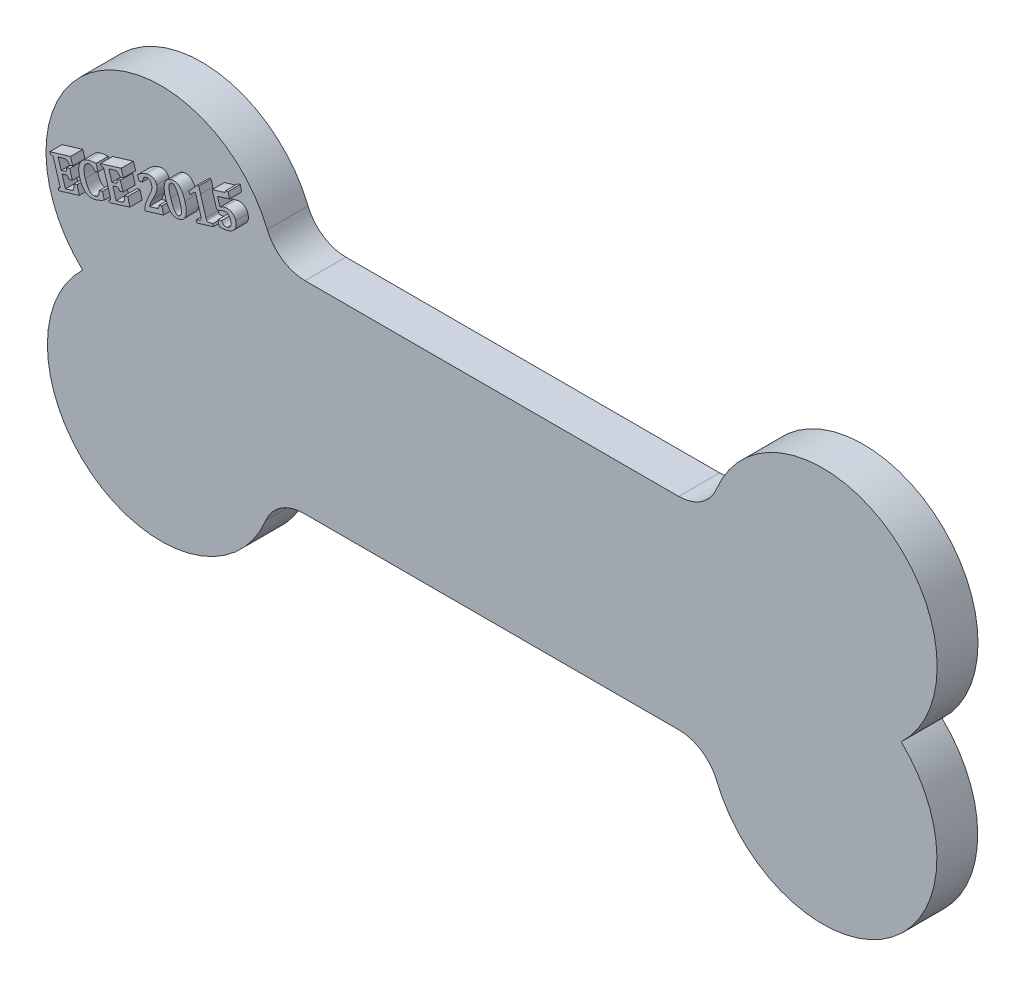
from build123d import *

# Parameters (mm, degrees)
SKETCH1_R           = 14.289546571
SKETCH1_R_2         = 14.252467891
SKETCH1_R_3         = 14.113624557
SKETCH1_R_4         = 14.218971536
SKETCH1_W           = 100.079406418
SKETCH1_H           = 25.144313168
BOSS_EXTRUDE1_DEPTH = 5.08
FILLET1_R           = 5.08
FILLET2_R           = 5.08
FILLET3_R           = 5.08
FILLET4_R           = 5.08
BOSS_EXTRUDE2_DEPTH = 1.524


with BuildPart() as part:
    # Sketch1 → Boss-Extrude1 (new body)
    with BuildSketch(Plane.XY):
        with Locations((-41.16080486, 10.341389949)):
            Circle(SKETCH1_R)
        with Locations((41.16080486, 10.341389949)):
            Circle(SKETCH1_R_2)
        with Locations((-41.16080486, -10.341389949)):
            Circle(SKETCH1_R_3)
        with Locations((41.16080486, -10.341389949)):
            Circle(SKETCH1_R_4)
        Rectangle(SKETCH1_W, SKETCH1_H)
    extrude(amount=BOSS_EXTRUDE1_DEPTH)

    # Fillet1
    fillet1_edges = [part.edges().sort_by_distance(p)[0] for p in [
        (27.083996941, 12.572156584, 2.54),
    ]]
    fillet(fillet1_edges, radius=FILLET1_R)

    # Fillet2
    fillet2_edges = [part.edges().sort_by_distance(p)[0] for p in [
        (-27.04645679, 12.572156584, 2.54),
    ]]
    fillet(fillet2_edges, radius=FILLET2_R)

    # Fillet3
    fillet3_edges = [part.edges().sort_by_distance(p)[0] for p in [
        (27.117912289, -12.572156584, 2.54),
    ]]
    fillet(fillet3_edges, radius=FILLET3_R)

    # Fillet4
    fillet4_edges = [part.edges().sort_by_distance(p)[0] for p in [
        (-27.224590225, -12.572156584, 2.54),
    ]]
    fillet(fillet4_edges, radius=FILLET4_R)

    # Sketch2 → Boss-Extrude2 (add)
    # profile 1 of 7: a face of its own
    with BuildSketch(Plane.XY.offset(5.08)):
        with BuildLine():
            Line((-50.60639535, 12.005929481), (-50.876098543, 12.894798848))
            Line((-50.876098543, 12.894798848), (-53.46048006, 12.109534976))
            Line((-53.46048006, 12.109534976), (-53.393876527, 11.889989999))
            add(Edge.make_bspline(
                [(-52.944097116, 11.500235993), (-52.957887359, 11.54973662), (-52.981139766, 11.616679117), (-53.0099987, 11.698050557), (-53.034458474, 11.751190268), (-53.06016311, 11.801376889), (-53.096810298, 11.844051331), (-53.137359515, 11.869870685), (-53.176501014, 11.882965262), (-53.217566782, 11.887305671), (-53.288203729, 11.892802268), (-53.348727026, 11.889897299), (-53.393876527, 11.889989999)],
                knots=[0, 0, 0, 0, 0.224874076, 0.310761561, 0.377954199, 0.481192858, 0.556895112, 0.621191654, 0.689554798, 0.735586859, 0.801817313, 1, 1, 1, 1], degree=3))
            Line((-52.944097116, 11.500235993), (-52.261616474, 9.255450266))
            add(Edge.make_bspline(
                [(-52.419491514, 8.683153246), (-52.371641974, 8.711085179), (-52.310419646, 8.752538841), (-52.241806102, 8.805305751), (-52.214143184, 8.837298233), (-52.201610858, 8.869653359), (-52.192514517, 8.902685606), (-52.1922069, 8.940590743), (-52.194290601, 8.983838483), (-52.203925775, 9.035292335), (-52.222717719, 9.127671213), (-52.246121284, 9.201653855), (-52.261616474, 9.255450266)],
                knots=[0, 0, 0, 0, 0.24185375, 0.322647174, 0.377998681, 0.423593048, 0.472961744, 0.526896437, 0.5880677, 0.662082012, 0.75507664, 1, 1, 1, 1], degree=3))
            Line((-52.419491514, 8.683153246), (-52.352065715, 8.461963737))
            Line((-52.352065715, 8.461963737), (-49.794818972, 9.23900495))
            Line((-49.794818972, 9.23900495), (-50.050543646, 10.271770837))
            Line((-50.050543646, 10.271770837), (-50.452631639, 10.149253228))
            add(Edge.make_bspline(
                [(-50.804561416, 9.296563558), (-50.768256245, 9.30728359), (-50.718090314, 9.325504179), (-50.65660397, 9.351485323), (-50.610708742, 9.377767503), (-50.562672837, 9.415550768), (-50.519025972, 9.474390479), (-50.488843827, 9.546124419), (-50.468688529, 9.629502311), (-50.456269517, 9.721311998), (-50.45160728, 9.804115071), (-50.450842937, 9.880370029), (-50.450881029, 9.99110783), (-50.452534683, 10.082646505), (-50.452631639, 10.149253228)],
                knots=[0, 0, 0, 0, 0.110437642, 0.155960841, 0.19468998, 0.264711615, 0.332764861, 0.406252598, 0.490527799, 0.582693775, 0.676534569, 0.732584137, 0.805441141, 1, 1, 1, 1], degree=3))
            Line((-50.804561416, 9.296563558), (-51.506776438, 9.083596707))
            Line((-51.506776438, 9.083596707), (-51.930243343, 10.475692764))
            Line((-51.930243343, 10.475692764), (-51.479641665, 10.612188893))
            add(Edge.make_bspline(
                [(-51.038084913, 10.330151712), (-51.06704983, 10.379558991), (-51.106044881, 10.447787397), (-51.162839901, 10.523296081), (-51.20325782, 10.570234507), (-51.251872986, 10.609421044), (-51.304619611, 10.632966887), (-51.349176958, 10.637091111), (-51.404842285, 10.632324656), (-51.448994851, 10.622850166), (-51.479641665, 10.612188893)],
                knots=[0, 0, 0, 0, 0.292723782, 0.3995801, 0.481814788, 0.608289109, 0.715556537, 0.770389573, 0.834863604, 1, 1, 1, 1], degree=3))
            Line((-51.038084913, 10.330151712), (-50.64586411, 10.449380258))
            Line((-50.64586411, 10.449380258), (-50.980526304, 11.551216475))
            Line((-50.980526304, 11.551216475), (-51.371924841, 11.431987929))
            add(Edge.make_bspline(
                [(-51.580780363, 10.946028821), (-51.551122062, 10.955393057), (-51.509485727, 10.969991973), (-51.461919136, 10.996971318), (-51.426130894, 11.023836926), (-51.392378732, 11.070831115), (-51.37448949, 11.130701699), (-51.366358712, 11.192470079), (-51.363904773, 11.290375983), (-51.368658902, 11.372006354), (-51.371924841, 11.431987929)],
                knots=[0, 0, 0, 0, 0.157418316, 0.221276102, 0.275533999, 0.382377757, 0.506233221, 0.587263332, 0.696675603, 1, 1, 1, 1], degree=3))
            Line((-51.580780363, 10.946028821), (-52.03138204, 10.809532693))
            Line((-52.03138204, 10.809532693), (-52.412913387, 12.064310356))
            Line((-52.412913387, 12.064310356), (-51.697542111, 12.281388536))
            add(Edge.make_bspline(
                [(-51.005194279, 11.885056404), (-51.035266082, 11.929809285), (-51.078657712, 11.992231962), (-51.136016698, 12.06786277), (-51.182975154, 12.123999988), (-51.234708606, 12.182287837), (-51.294718146, 12.238052126), (-51.35135991, 12.279386237), (-51.408744459, 12.306304509), (-51.470128211, 12.320626012), (-51.56858767, 12.316764205), (-51.644305301, 12.297265922), (-51.697542111, 12.281388536)],
                knots=[0, 0, 0, 0, 0.182972254, 0.257946892, 0.322020039, 0.431328752, 0.522180258, 0.599601812, 0.668270096, 0.735967643, 0.811316394, 1, 1, 1, 1], degree=3))
            Line((-51.005194279, 11.885056404), (-50.60639535, 12.005929481))
        make_face()
    # profile 2 of 7: a face of its own
    with BuildSketch(Plane.XY.offset(5.08)):
        with BuildLine():
            Line((-47.461857404, 12.930946155), (-47.705248091, 13.732655343))
            add(Edge.make_bspline(
                [(-48.746236637, 13.569024442), (-48.595310858, 13.614463311), (-48.403151167, 13.662840296), (-48.162527232, 13.69990875), (-47.968808037, 13.720151633), (-47.814197697, 13.728757888), (-47.705248091, 13.732655343)],
                knots=[0, 0, 0, 0, 0.447472762, 0.560770241, 0.690635786, 1, 1, 1, 1], degree=3))
            add(Edge.make_bspline(
                [(-49.723088448, 11.195965245), (-49.750729195, 11.287654468), (-49.786607413, 11.424937791), (-49.823005456, 11.607815648), (-49.840359925, 11.740845718), (-49.85352322, 11.870785659), (-49.858039055, 11.998181325), (-49.856893956, 12.123103354), (-49.847435507, 12.245219606), (-49.83271871, 12.364368549), (-49.808155544, 12.478975749), (-49.778156631, 12.589621684), (-49.740075769, 12.695540049), (-49.695865066, 12.797648166), (-49.642716467, 12.894486908), (-49.583481451, 12.987868372), (-49.517133557, 13.076803275), (-49.442779073, 13.159505674), (-49.363087481, 13.237351852), (-49.276032014, 13.308435042), (-49.182573534, 13.372893294), (-49.082963081, 13.431937281), (-48.939508934, 13.503041239), (-48.82470072, 13.544475086), (-48.746236637, 13.569024442)],
                knots=[0, 0, 0, 0, 0.099123032, 0.146814076, 0.192922299, 0.237956323, 0.281970453, 0.324820404, 0.367214155, 0.408709567, 0.449000015, 0.488445295, 0.527306564, 0.565423127, 0.603513277, 0.64153255, 0.679838749, 0.718224735, 0.756551947, 0.795063577, 0.834418943, 0.873982433, 0.914843364, 1, 1, 1, 1], degree=3))
            add(Edge.make_bspline(
                [(-47.780896548, 9.787423872), (-47.888810725, 9.753900797), (-48.051132886, 9.719387515), (-48.266354088, 9.706927941), (-48.417590107, 9.717069979), (-48.563082733, 9.743729838), (-48.702236278, 9.789584884), (-48.835218, 9.852671464), (-48.961441979, 9.934000055), (-49.081241129, 10.03270648), (-49.193957271, 10.1484477), (-49.299631718, 10.281145155), (-49.398093404, 10.431008488), (-49.491139355, 10.597316595), (-49.60852434, 10.850625634), (-49.678892493, 11.054755184), (-49.723088448, 11.195965245)],
                knots=[0, 0, 0, 0, 0.124043543, 0.181306073, 0.236200668, 0.290093607, 0.343296384, 0.396607163, 0.45129097, 0.507745811, 0.566698889, 0.628366646, 0.693725999, 0.763386922, 0.837442092, 1, 1, 1, 1], degree=3))
            add(Edge.make_bspline(
                [(-46.660148216, 10.293939626), (-46.753503591, 10.236097298), (-46.891643845, 10.154812144), (-47.075875381, 10.05807004), (-47.207733162, 9.996444093), (-47.341233156, 9.940446754), (-47.53104424, 9.867603182), (-47.678991769, 9.817927219), (-47.780896548, 9.787423872)],
                knots=[0, 0, 0, 0, 0.267008729, 0.389509288, 0.50577204, 0.62074817, 0.741407939, 1, 1, 1, 1], degree=3))
            Line((-46.660148216, 10.293939626), (-46.910939295, 11.118672257))
            Line((-46.910939295, 11.118672257), (-47.311382757, 10.996976914))
            add(Edge.make_bspline(
                [(-47.8277657, 10.136886851), (-47.766695899, 10.15460443), (-47.681501741, 10.187038879), (-47.580635114, 10.24352129), (-47.51992799, 10.288416856), (-47.46929493, 10.339858995), (-47.427476818, 10.398213585), (-47.391360203, 10.462665309), (-47.363952728, 10.53707678), (-47.342235401, 10.624972421), (-47.319823354, 10.779360462), (-47.312816097, 10.906049316), (-47.311382757, 10.996976914)],
                knots=[0, 0, 0, 0, 0.172645421, 0.246300972, 0.313274232, 0.376945593, 0.441394939, 0.507674199, 0.576915899, 0.655967326, 0.753109198, 1, 1, 1, 1], degree=3))
            add(Edge.make_bspline(
                [(-49.052119527, 11.447578591), (-49.027049617, 11.365328765), (-48.988068994, 11.245037349), (-48.930195495, 11.090479664), (-48.885108078, 10.983395928), (-48.840856501, 10.881219462), (-48.792518451, 10.786053897), (-48.744337817, 10.696027498), (-48.694260059, 10.612429488), (-48.643351287, 10.534977316), (-48.591609455, 10.464063741), (-48.538982864, 10.399997516), (-48.486395822, 10.342234694), (-48.43365129, 10.290872376), (-48.38043292, 10.246024406), (-48.325622294, 10.209235869), (-48.254812616, 10.167717398), (-48.163260905, 10.1314825), (-48.013528455, 10.101913871), (-47.899211608, 10.114695689), (-47.8277657, 10.136886851)],
                knots=[0, 0, 0, 0, 0.130272212, 0.19150934, 0.249963193, 0.306291391, 0.360145413, 0.411612433, 0.460963821, 0.507722774, 0.55199077, 0.593887395, 0.633272306, 0.670273471, 0.705363576, 0.738533885, 0.770158055, 0.829609292, 0.886697648, 1, 1, 1, 1], degree=3))
            add(Edge.make_bspline(
                [(-48.696078421, 13.219561463), (-48.767545918, 13.199271208), (-48.867053325, 13.143645062), (-48.979059014, 13.038488252), (-49.039138576, 12.957125006), (-49.081489132, 12.883461915), (-49.110045297, 12.821835537), (-49.135020564, 12.755156908), (-49.154106975, 12.682481417), (-49.171902162, 12.605073248), (-49.183770088, 12.521714713), (-49.19171519, 12.433332504), (-49.197012418, 12.340080347), (-49.196681049, 12.242105819), (-49.192048114, 12.139980173), (-49.180589345, 12.033939789), (-49.166359523, 11.923803397), (-49.14553128, 11.809971449), (-49.109011894, 11.650289542), (-49.077877677, 11.528828019), (-49.052119527, 11.447578591)],
                knots=[0, 0, 0, 0, 0.111151475, 0.168977248, 0.23032394, 0.262685756, 0.296853573, 0.33251268, 0.369770504, 0.40993619, 0.452089415, 0.496454788, 0.543582622, 0.59270947, 0.643960364, 0.697485256, 0.753301427, 0.811199363, 0.871694199, 1, 1, 1, 1], degree=3))
            add(Edge.make_bspline(
                [(-47.864767663, 12.808428546), (-47.908897761, 12.876958392), (-47.972757319, 12.973173626), (-48.069053676, 13.080260656), (-48.135209385, 13.138622205), (-48.200624329, 13.182710666), (-48.265219488, 13.217680976), (-48.331405972, 13.24051463), (-48.398641664, 13.254216157), (-48.467743908, 13.257587099), (-48.56841201, 13.253728817), (-48.644360296, 13.233724256), (-48.696078421, 13.219561463)],
                knots=[0, 0, 0, 0, 0.24020046, 0.338390045, 0.42297995, 0.49903129, 0.570095912, 0.638450218, 0.704244686, 0.771302193, 0.841538313, 1, 1, 1, 1], degree=3))
            Line((-47.864767663, 12.808428546), (-47.461857404, 12.930946155))
        make_face()
    # profile 3 of 7: a face of its own
    with BuildSketch(Plane.XY.offset(5.08)):
        with BuildLine():
            Line((-44.301973566, 13.8836985), (-44.57167676, 14.772567867))
            Line((-44.57167676, 14.772567867), (-47.156058276, 13.987303996))
            Line((-47.156058276, 13.987303996), (-47.089454743, 13.767759018))
            add(Edge.make_bspline(
                [(-46.639675332, 13.378005013), (-46.653465575, 13.427505639), (-46.676717983, 13.494448136), (-46.705576916, 13.575819576), (-46.730036691, 13.628959287), (-46.755741326, 13.679145908), (-46.792388514, 13.721820351), (-46.832937731, 13.747639704), (-46.87207923, 13.760734281), (-46.913144999, 13.765074691), (-46.983781945, 13.770571287), (-47.044305242, 13.767666318), (-47.089454743, 13.767759018)],
                knots=[0, 0, 0, 0, 0.224874076, 0.310761561, 0.377954199, 0.481192858, 0.556895112, 0.621191654, 0.689554798, 0.735586859, 0.801817313, 1, 1, 1, 1], degree=3))
            Line((-46.639675332, 13.378005013), (-45.95719469, 11.133219286))
            add(Edge.make_bspline(
                [(-46.11506973, 10.560922265), (-46.06722019, 10.588854198), (-46.005997862, 10.630307861), (-45.937384319, 10.68307477), (-45.9097214, 10.715067252), (-45.897189074, 10.747422378), (-45.888092733, 10.780454625), (-45.887785117, 10.818359762), (-45.889868818, 10.861607502), (-45.899503992, 10.913061354), (-45.918295935, 11.005440232), (-45.9416995, 11.079422874), (-45.95719469, 11.133219286)],
                knots=[0, 0, 0, 0, 0.24185375, 0.322647174, 0.377998681, 0.423593048, 0.472961744, 0.526896437, 0.5880677, 0.662082012, 0.75507664, 1, 1, 1, 1], degree=3))
            Line((-46.11506973, 10.560922265), (-46.047643932, 10.339732756))
            Line((-46.047643932, 10.339732756), (-43.490397188, 11.116773969))
            Line((-43.490397188, 11.116773969), (-43.746121862, 12.149539856))
            Line((-43.746121862, 12.149539856), (-44.148209855, 12.027022247))
            add(Edge.make_bspline(
                [(-44.500139632, 11.174332577), (-44.463834461, 11.185052609), (-44.413668531, 11.203273199), (-44.352182187, 11.229254343), (-44.306286958, 11.255536522), (-44.258251053, 11.293319787), (-44.214604188, 11.352159498), (-44.184422044, 11.423893439), (-44.164266746, 11.50727133), (-44.151847734, 11.599081017), (-44.147185496, 11.68188409), (-44.146421153, 11.758139048), (-44.146459245, 11.868876849), (-44.1481129, 11.960415524), (-44.148209855, 12.027022247)],
                knots=[0, 0, 0, 0, 0.110437642, 0.155960841, 0.19468998, 0.264711615, 0.332764861, 0.406252598, 0.490527799, 0.582693775, 0.676534569, 0.732584137, 0.805441141, 1, 1, 1, 1], degree=3))
            Line((-44.500139632, 11.174332577), (-45.202354654, 10.961365726))
            Line((-45.202354654, 10.961365726), (-45.625821559, 12.353461783))
            Line((-45.625821559, 12.353461783), (-45.175219882, 12.489957912))
            add(Edge.make_bspline(
                [(-44.733663129, 12.207920731), (-44.762628046, 12.25732801), (-44.801623098, 12.325556416), (-44.858418117, 12.4010651), (-44.898836036, 12.448003526), (-44.947451203, 12.487190064), (-45.000197827, 12.510735906), (-45.044755175, 12.51486013), (-45.100420501, 12.510093675), (-45.144573067, 12.500619185), (-45.175219882, 12.489957912)],
                knots=[0, 0, 0, 0, 0.292723782, 0.3995801, 0.481814788, 0.608289109, 0.715556537, 0.770389573, 0.834863604, 1, 1, 1, 1], degree=3))
            Line((-44.733663129, 12.207920731), (-44.341442326, 12.327149277))
            Line((-44.341442326, 12.327149277), (-44.676104521, 13.428985494))
            Line((-44.676104521, 13.428985494), (-45.067503058, 13.309756948))
            add(Edge.make_bspline(
                [(-45.276358579, 12.82379784), (-45.246700278, 12.833162076), (-45.205063943, 12.847760992), (-45.157497353, 12.874740337), (-45.12170911, 12.901605945), (-45.087956948, 12.948600135), (-45.070067707, 13.008470718), (-45.061936929, 13.070239099), (-45.059482989, 13.168145002), (-45.064237119, 13.249775373), (-45.067503058, 13.309756948)],
                knots=[0, 0, 0, 0, 0.157418316, 0.221276102, 0.275533999, 0.382377757, 0.506233221, 0.587263332, 0.696675603, 1, 1, 1, 1], degree=3))
            Line((-45.276358579, 12.82379784), (-45.726960256, 12.687301712))
            Line((-45.726960256, 12.687301712), (-46.108491603, 13.942079375))
            Line((-46.108491603, 13.942079375), (-45.393120328, 14.159157555))
            add(Edge.make_bspline(
                [(-44.700772496, 13.762825423), (-44.730844298, 13.807578304), (-44.774235929, 13.870000981), (-44.831594914, 13.945631789), (-44.87855337, 14.001769007), (-44.930286822, 14.060056856), (-44.990296362, 14.115821145), (-45.046938126, 14.157155256), (-45.104322676, 14.184073528), (-45.165706427, 14.198395031), (-45.264165886, 14.194533224), (-45.339883517, 14.175034941), (-45.393120328, 14.159157555)],
                knots=[0, 0, 0, 0, 0.182972254, 0.257946892, 0.322020039, 0.431328752, 0.522180258, 0.599601812, 0.668270096, 0.735967643, 0.811316394, 1, 1, 1, 1], degree=3))
            Line((-44.700772496, 13.762825423), (-44.301973566, 13.8836985))
        make_face()
    # profile 4 of 7: a face of its own
    with BuildSketch(Plane.XY.offset(5.08)):
        with BuildLine():
            Line((-39.513375385, 13.242077078), (-39.876816884, 13.131071191))
            add(Edge.make_bspline(
                [(-40.206545483, 12.656623804), (-40.169827288, 12.668147197), (-40.118608915, 12.684883019), (-40.056277532, 12.709492352), (-40.010822533, 12.73151538), (-39.966232987, 12.760010813), (-39.925137757, 12.799611299), (-39.901572426, 12.847304879), (-39.890713505, 12.893188636), (-39.886139023, 12.940258984), (-39.879712595, 13.017456679), (-39.87824677, 13.082835651), (-39.876816884, 13.131071191)],
                knots=[0, 0, 0, 0, 0.175900889, 0.2461514, 0.306096943, 0.406506657, 0.487117187, 0.563314564, 0.645953288, 0.701425816, 0.779343947, 1, 1, 1, 1], degree=3))
            Line((-40.206545483, 12.656623804), (-41.079791799, 12.39103194))
            add(Edge.make_bspline(
                [(-40.635768249, 13.424620093), (-40.686246157, 13.324306973), (-40.757240059, 13.176656316), (-40.845141784, 12.983694462), (-40.904048719, 12.850971153), (-40.956305388, 12.725533926), (-41.017108146, 12.574019535), (-41.056911664, 12.463099456), (-41.079791799, 12.39103194)],
                knots=[0, 0, 0, 0, 0.299221099, 0.43648775, 0.564998203, 0.686122084, 0.798551459, 1, 1, 1, 1], degree=3))
            add(Edge.make_bspline(
                [(-40.151453672, 15.17604632), (-40.125370963, 15.091249428), (-40.099625776, 14.961172602), (-40.101438306, 14.784686675), (-40.118259116, 14.649481589), (-40.153590817, 14.504874163), (-40.205665467, 14.349845412), (-40.271746194, 14.185979972), (-40.326841647, 14.058516293), (-40.369821593, 13.969051414), (-40.395083111, 13.914137428), (-40.426046697, 13.852167172), (-40.459018146, 13.781102311), (-40.498252574, 13.703540163), (-40.556357615, 13.583222883), (-40.604441823, 13.490356068), (-40.635768249, 13.424620093)],
                knots=[0, 0, 0, 0, 0.142877058, 0.211226361, 0.283203248, 0.36160136, 0.450286859, 0.546090663, 0.645798948, 0.673610533, 0.705763917, 0.743036927, 0.785048072, 0.831785043, 0.882861535, 1, 1, 1, 1], degree=3))
            add(Edge.make_bspline(
                [(-41.49996964, 15.725319897), (-41.416307466, 15.751927213), (-41.29186907, 15.781302322), (-41.128237106, 15.804720544), (-41.015163462, 15.811915453), (-40.907828418, 15.807479786), (-40.806116654, 15.794784215), (-40.710283302, 15.77194163), (-40.620803483, 15.738605075), (-40.5376187, 15.696918165), (-40.461548114, 15.64616995), (-40.39183295, 15.58827038), (-40.328627607, 15.522167279), (-40.273942907, 15.446639484), (-40.207255397, 15.334216261), (-40.171138855, 15.240760309), (-40.151453672, 15.17604632)],
                knots=[0, 0, 0, 0, 0.159197131, 0.231499835, 0.299749873, 0.364450349, 0.426137099, 0.485484012, 0.54276103, 0.599031696, 0.653929618, 0.708309228, 0.763186873, 0.819387167, 0.877130812, 1, 1, 1, 1], degree=3))
            add(Edge.make_bspline(
                [(-42.540958186, 15.081485749), (-42.447534347, 15.165526853), (-42.309182685, 15.284207299), (-42.11838708, 15.419769622), (-41.986621155, 15.504480326), (-41.858697687, 15.575398761), (-41.700040131, 15.654635052), (-41.57924663, 15.700543518), (-41.49996964, 15.725319897)],
                knots=[0, 0, 0, 0, 0.305774494, 0.442459421, 0.568936841, 0.686508214, 0.797996807, 1, 1, 1, 1], degree=3))
            Line((-42.540958186, 15.081485749), (-42.363348766, 14.497677007))
            Line((-42.363348766, 14.497677007), (-41.907813494, 14.635817667))
            add(Edge.make_bspline(
                [(-41.506547767, 15.347077613), (-41.568903336, 15.327802171), (-41.658219417, 15.283521583), (-41.75215613, 15.191535694), (-41.808644518, 15.107885609), (-41.853448264, 15.010522571), (-41.8958027, 14.852673351), (-41.907536936, 14.72494422), (-41.907813494, 14.635817667)],
                knots=[0, 0, 0, 0, 0.222856957, 0.332542426, 0.444765561, 0.565170396, 0.69621394, 1, 1, 1, 1], degree=3))
            add(Edge.make_bspline(
                [(-40.796932352, 14.894009139), (-40.814547108, 14.951242973), (-40.845777142, 15.033702273), (-40.903777245, 15.132192518), (-40.950307111, 15.196577113), (-41.002157552, 15.252686694), (-41.060436853, 15.297744856), (-41.122552496, 15.335210659), (-41.190629352, 15.360417066), (-41.263218424, 15.375591088), (-41.370410448, 15.379898363), (-41.452073601, 15.362848994), (-41.506547767, 15.347077613)],
                knots=[0, 0, 0, 0, 0.188393342, 0.275231115, 0.358418761, 0.437610895, 0.514267192, 0.589142362, 0.66462901, 0.741130387, 0.821285732, 1, 1, 1, 1], degree=3))
            add(Edge.make_bspline(
                [(-40.896426518, 14.001028443), (-40.868749213, 14.06968479), (-40.835876862, 14.169440364), (-40.798503118, 14.296669104), (-40.775213746, 14.401467641), (-40.757368681, 14.519983437), (-40.754150014, 14.693163044), (-40.773298762, 14.816641288), (-40.796932352, 14.894009139)],
                knots=[0, 0, 0, 0, 0.242226679, 0.343959769, 0.434126939, 0.5937135, 0.735580459, 1, 1, 1, 1], degree=3))
            add(Edge.make_bspline(
                [(-41.175174636, 13.368706017), (-41.144569878, 13.434530331), (-41.099528148, 13.52949014), (-41.043625398, 13.652423333), (-41.007584674, 13.734835329), (-40.974465167, 13.810659671), (-40.937186454, 13.898421625), (-40.912005415, 13.96143362), (-40.896426518, 14.001028443)],
                knots=[0, 0, 0, 0, 0.315081509, 0.456171868, 0.586145986, 0.705493337, 0.815311141, 1, 1, 1, 1], degree=3))
            add(Edge.make_bspline(
                [(-41.646332959, 11.857381414), (-41.635317972, 11.967375074), (-41.611836354, 12.134034638), (-41.559511903, 12.355355368), (-41.521309629, 12.498168695), (-41.484086338, 12.615877013), (-41.451964288, 12.709623953), (-41.415680095, 12.808280057), (-41.375566101, 12.911705791), (-41.330872895, 13.019205642), (-41.265764804, 13.172937348), (-41.211766161, 13.289143942), (-41.175174636, 13.368706017)],
                knots=[0, 0, 0, 0, 0.208483012, 0.316657381, 0.428598252, 0.487105197, 0.549364155, 0.615408596, 0.68526655, 0.758483699, 0.834882842, 1, 1, 1, 1], degree=3))
            Line((-41.646332959, 11.857381414), (-41.58877435, 11.668260272))
            Line((-41.58877435, 11.668260272), (-39.298764002, 12.363897168))
            Line((-39.298764002, 12.363897168), (-39.513375385, 13.242077078))
        make_face()
    # profile 5 of 7: a face of its own
    with BuildSketch(Plane.XY.offset(5.08)):
        with BuildLine():
            Line((-33.08480067, 14.214689579), (-33.172783114, 14.504949418))
            add(Edge.make_bspline(
                [(-34.030406379, 14.725316661), (-34.016263635, 14.680994441), (-33.997036598, 14.619221671), (-33.96738014, 14.545600898), (-33.942889852, 14.495772868), (-33.91204061, 14.449999842), (-33.870413067, 14.409563959), (-33.819211012, 14.390476605), (-33.771610516, 14.383792707), (-33.726377482, 14.385600031), (-33.684693363, 14.388904675), (-33.636639151, 14.394667338), (-33.579621649, 14.40446917), (-33.507880758, 14.418813762), (-33.370794628, 14.453703792), (-33.256290646, 14.481838017), (-33.172783114, 14.504949418)],
                knots=[0, 0, 0, 0, 0.130312052, 0.180896438, 0.222074686, 0.285502148, 0.334950587, 0.381403035, 0.435660141, 0.46866345, 0.507916506, 0.552743516, 0.604084615, 0.669845481, 0.757500518, 1, 1, 1, 1], degree=3))
            Line((-34.030406379, 14.725316661), (-34.703842097, 16.941323084))
            add(Edge.make_bspline(
                [(-34.914342151, 17.689584993), (-34.902144878, 17.638706584), (-34.881881237, 17.559685122), (-34.852299966, 17.450728788), (-34.826568634, 17.360422766), (-34.799523748, 17.2638407), (-34.759129237, 17.123291987), (-34.726161445, 17.015289923), (-34.703842097, 16.941323084)],
                knots=[0, 0, 0, 0, 0.201896534, 0.3147945, 0.435674731, 0.564255169, 0.701843017, 1, 1, 1, 1], degree=3))
            Line((-34.914342151, 17.689584993), (-35.176644952, 17.609825207))
            Line((-35.176644952, 17.609825207), (-36.198721383, 16.470164761))
            Line((-36.198721383, 16.470164761), (-35.959442026, 16.24733072))
            add(Edge.make_bspline(
                [(-35.432369626, 16.759602335), (-35.455477905, 16.751112263), (-35.49024415, 16.723711027), (-35.540910151, 16.677468339), (-35.582687534, 16.635528375), (-35.62115223, 16.594277421), (-35.656584852, 16.558430292), (-35.696244212, 16.518052156), (-35.739847691, 16.472583975), (-35.788112723, 16.422456437), (-35.862621822, 16.347569799), (-35.919432639, 16.287909506), (-35.959442026, 16.24733072)],
                knots=[0, 0, 0, 0, 0.098831903, 0.178614143, 0.279600639, 0.33958213, 0.408225923, 0.484758818, 0.569980783, 0.664668772, 0.76802515, 1, 1, 1, 1], degree=3))
            add(Edge.make_bspline(
                [(-35.298340295, 16.639551523), (-35.30636498, 16.662992014), (-35.315905532, 16.696698923), (-35.339339317, 16.731415051), (-35.369238746, 16.762783949), (-35.407402395, 16.770050968), (-35.432369626, 16.759602335)],
                knots=[0, 0, 0, 0, 0.367684553, 0.5039895, 0.612226931, 1, 1, 1, 1], degree=3))
            Line((-35.298340295, 16.639551523), (-34.658617476, 14.534550988))
            add(Edge.make_bspline(
                [(-35.249004345, 13.875093789), (-35.198308381, 13.893486232), (-35.125429916, 13.919401582), (-35.033134147, 13.953881783), (-34.974325943, 13.976947303), (-34.922303656, 13.997244929), (-34.877652512, 14.016265945), (-34.840161779, 14.033411267), (-34.800229249, 14.052569465), (-34.759207117, 14.075715213), (-34.717012369, 14.102316381), (-34.683606863, 14.128760755), (-34.64951317, 14.163037572), (-34.620280439, 14.215227056), (-34.610538477, 14.277052355), (-34.611691889, 14.335298187), (-34.62539974, 14.418994723), (-34.644181998, 14.485979085), (-34.658617476, 14.534550988)],
                knots=[0, 0, 0, 0, 0.153580335, 0.220270637, 0.280570408, 0.333475411, 0.379289164, 0.418759118, 0.45087573, 0.505385912, 0.552800768, 0.592784485, 0.626456914, 0.69006583, 0.759112609, 0.802050006, 0.855698335, 1, 1, 1, 1], degree=3))
            Line((-35.249004345, 13.875093789), (-35.160199635, 13.584011684))
            Line((-35.160199635, 13.584011684), (-33.08480067, 14.214689579))
        make_face()
    # profile 6 of 7: a face of its own
    with BuildSketch(Plane.XY.offset(5.08)):
        with BuildLine():
            Line((-32.547399735, 15.232179557), (-32.353344998, 14.592456739))
            add(Edge.make_bspline(
                [(-31.300022465, 14.694417702), (-31.378055307, 14.670414418), (-31.498967509, 14.641698005), (-31.664110537, 14.613491788), (-31.793906052, 14.597871112), (-31.927808176, 14.588063274), (-32.114903499, 14.582959658), (-32.257278939, 14.586024818), (-32.353344998, 14.592456739)],
                knots=[0, 0, 0, 0, 0.230109159, 0.350066547, 0.472305753, 0.598638229, 0.728552008, 1, 1, 1, 1], degree=3))
            add(Edge.make_bspline(
                [(-30.329748781, 16.253433723), (-30.29658257, 16.143520797), (-30.263075975, 15.976045093), (-30.26755713, 15.753591473), (-30.288672325, 15.621796212), (-30.317159099, 15.520639481), (-30.344579864, 15.447038155), (-30.377357039, 15.375459362), (-30.416244217, 15.30625589), (-30.460628543, 15.239113581), (-30.512275909, 15.175410802), (-30.567930968, 15.112215623), (-30.652263807, 15.032251981), (-30.769186499, 14.937969436), (-30.988583603, 14.806312081), (-31.171344023, 14.732930624), (-31.300022465, 14.694417702)],
                knots=[0, 0, 0, 0, 0.166021896, 0.243994348, 0.320174885, 0.35800682, 0.395568746, 0.433460652, 0.471550406, 0.510073477, 0.54950253, 0.589857974, 0.631558808, 0.717152827, 0.806125969, 1, 1, 1, 1], degree=3))
            add(Edge.make_bspline(
                [(-31.807360484, 16.979494455), (-31.698080939, 17.012695895), (-31.53200403, 17.045592966), (-31.310632295, 17.047242551), (-31.153719041, 17.027361465), (-31.004767043, 16.989285156), (-30.867121068, 16.932279392), (-30.741511, 16.857350716), (-30.63000995, 16.763930574), (-30.531629093, 16.65566324), (-30.41877449, 16.490751909), (-30.358849704, 16.351029683), (-30.329748781, 16.253433723)],
                knots=[0, 0, 0, 0, 0.185208964, 0.272292729, 0.35782118, 0.440906308, 0.520777653, 0.598498261, 0.677058843, 0.755691005, 0.834933349, 1, 1, 1, 1], degree=3))
            add(Edge.make_bspline(
                [(-32.276874275, 16.711435793), (-32.274810133, 16.738547161), (-32.243954133, 16.775105541), (-32.185457564, 16.816923518), (-32.045104079, 16.893544966), (-31.91567416, 16.946114575), (-31.807360484, 16.979494455)],
                knots=[0, 0, 0, 0, 0.138738628, 0.247649917, 0.388795225, 1, 1, 1, 1], degree=3))
            Line((-32.276874275, 16.711435793), (-32.590979824, 17.745023946))
            Line((-32.590979824, 17.745023946), (-31.104323196, 18.197270155))
            Line((-31.104323196, 18.197270155), (-31.27535449, 18.918397291))
            Line((-31.27535449, 18.918397291), (-31.619061608, 18.81396953))
            add(Edge.make_bspline(
                [(-31.774469851, 18.578801502), (-31.752221198, 18.584898016), (-31.723344438, 18.596187442), (-31.688733315, 18.610221072), (-31.668280183, 18.623205664), (-31.649646353, 18.640520636), (-31.63698159, 18.663214339), (-31.631130286, 18.688791365), (-31.62369631, 18.738025006), (-31.621870642, 18.781400987), (-31.619061608, 18.81396953)],
                knots=[0, 0, 0, 0, 0.216816435, 0.293218683, 0.351327858, 0.444596931, 0.530241994, 0.591706336, 0.691184984, 1, 1, 1, 1], degree=3))
            Line((-31.774469851, 18.578801502), (-33.25701515, 18.128199825))
            Line((-33.25701515, 18.128199825), (-32.712675168, 16.336482573))
            Line((-32.712675168, 16.336482573), (-32.410903606, 16.272345837))
            add(Edge.make_bspline(
                [(-31.860807763, 16.539582234), (-31.954102921, 16.510874378), (-32.067328196, 16.468661966), (-32.196523092, 16.401479951), (-32.288704338, 16.347323486), (-32.361522189, 16.304779429), (-32.410903606, 16.272345837)],
                knots=[0, 0, 0, 0, 0.477531844, 0.587782631, 0.711408393, 1, 1, 1, 1], degree=3))
            add(Edge.make_bspline(
                [(-30.973582929, 15.996064517), (-30.996458796, 16.07618238), (-31.041452721, 16.187765833), (-31.121204376, 16.31971072), (-31.187382669, 16.398002112), (-31.258465972, 16.461952799), (-31.333619131, 16.512418797), (-31.412818546, 16.549390033), (-31.496878279, 16.570316576), (-31.58342021, 16.580243505), (-31.706666412, 16.577625846), (-31.799182355, 16.557699642), (-31.860807763, 16.539582234)],
                knots=[0, 0, 0, 0, 0.210644969, 0.302844445, 0.388990432, 0.469057896, 0.544084518, 0.617333037, 0.689001278, 0.762305605, 0.837229557, 1, 1, 1, 1], degree=3))
            add(Edge.make_bspline(
                [(-31.383071314, 15.024146301), (-31.332567302, 15.039083874), (-31.259939065, 15.066321934), (-31.173206278, 15.116488936), (-31.115590529, 15.155539049), (-31.065790737, 15.200567192), (-31.022861267, 15.250107), (-30.986472661, 15.303950948), (-30.956291318, 15.361956984), (-30.934300194, 15.425190757), (-30.918736527, 15.493021576), (-30.909692388, 15.565467726), (-30.908249334, 15.642872147), (-30.914471925, 15.724757587), (-30.931314969, 15.84433859), (-30.955743041, 15.934572807), (-30.973582929, 15.996064517)],
                knots=[0, 0, 0, 0, 0.130959242, 0.191322012, 0.248532531, 0.303475275, 0.357516838, 0.410941946, 0.46451859, 0.519414938, 0.576706377, 0.637069148, 0.700383644, 0.768614564, 0.840807726, 1, 1, 1, 1], degree=3))
            add(Edge.make_bspline(
                [(-32.091864463, 15.370320218), (-32.062089179, 15.328168891), (-32.020556761, 15.266000517), (-31.958668888, 15.192582614), (-31.914353371, 15.146809628), (-31.871540725, 15.10694789), (-31.829751774, 15.073308182), (-31.787312121, 15.047949353), (-31.732684921, 15.021305198), (-31.661150645, 15.000718209), (-31.538212581, 14.990047578), (-31.444416088, 15.005159371), (-31.383071314, 15.024146301)],
                knots=[0, 0, 0, 0, 0.179680245, 0.259519217, 0.333691808, 0.401164206, 0.462961623, 0.51986538, 0.572744858, 0.674115001, 0.776577791, 1, 1, 1, 1], degree=3))
            Line((-32.091864463, 15.370320218), (-32.547399735, 15.232179557))
        make_face()
    # profile 7 of 7: a face of its own
    with BuildSketch(Plane.XY.offset(5.08)):
        with BuildLine():
            add(Edge.make_bspline(
                [(-37.338843175, 12.896250304), (-37.431316472, 12.868093769), (-37.571204675, 12.839200404), (-37.756998478, 12.836535085), (-37.887923475, 12.851910058), (-38.013342736, 12.885481749), (-38.134037254, 12.935025624), (-38.248826542, 13.003345315), (-38.35812535, 13.089103896), (-38.461678777, 13.192235849), (-38.56165998, 13.311135266), (-38.655689418, 13.447773427), (-38.746415737, 13.600321637), (-38.831680727, 13.770303139), (-38.941991736, 14.028141739), (-39.013494822, 14.233354302), (-39.056556502, 14.376328806)],
                knots=[0, 0, 0, 0, 0.113055791, 0.165589338, 0.216561765, 0.26659567, 0.316858705, 0.368550637, 0.422179103, 0.478802966, 0.539047977, 0.603467847, 0.672407375, 0.746321688, 0.825516812, 1, 1, 1, 1], degree=3))
            add(Edge.make_bspline(
                [(-36.649784406, 15.195305576), (-36.605720491, 15.050470287), (-36.549503554, 14.836745733), (-36.500250888, 14.555086086), (-36.478821438, 14.360369137), (-36.469505206, 14.176007852), (-36.47639744, 14.001676143), (-36.495371336, 13.83753999), (-36.529015434, 13.684033077), (-36.576065908, 13.54132874), (-36.639983744, 13.411233724), (-36.718555361, 13.292975253), (-36.813343714, 13.187864127), (-36.922932534, 13.095077101), (-37.093392902, 12.985496405), (-37.237706695, 12.926728059), (-37.338843175, 12.896250304)],
                knots=[0, 0, 0, 0, 0.167196051, 0.243673935, 0.315533922, 0.383397346, 0.447304547, 0.50797038, 0.565616635, 0.620554267, 0.673479155, 0.725188022, 0.776840169, 0.829234499, 0.883298977, 1, 1, 1, 1], degree=3))
            add(Edge.make_bspline(
                [(-38.431634468, 16.639204381), (-38.331177878, 16.669041454), (-38.180625487, 16.702006), (-37.981046886, 16.707851327), (-37.842153286, 16.695334261), (-37.709576895, 16.663592937), (-37.583525945, 16.613937549), (-37.464331427, 16.545568767), (-37.351648923, 16.459828228), (-37.245702918, 16.356790771), (-37.144462801, 16.238526105), (-37.047661847, 16.104641974), (-36.957985222, 15.953497186), (-36.87248173, 15.78701927), (-36.761597884, 15.53577565), (-36.691653674, 15.335107182), (-36.649784406, 15.195305576)],
                knots=[0, 0, 0, 0, 0.12070569, 0.175893968, 0.229092738, 0.280626334, 0.33213968, 0.384377117, 0.438156449, 0.494562009, 0.554021661, 0.617015426, 0.684322643, 0.755943679, 0.832152506, 1, 1, 1, 1], degree=3))
            add(Edge.make_bspline(
                [(-39.056556502, 14.376328806), (-39.102552997, 14.527534351), (-39.159927338, 14.749512352), (-39.208697278, 15.040356835), (-39.228000912, 15.237636132), (-39.232510486, 15.422364954), (-39.222829324, 15.595065586), (-39.200290479, 15.755878913), (-39.164306025, 15.904756556), (-39.115077577, 16.041905704), (-39.051747474, 16.166006788), (-38.976110198, 16.278426554), (-38.88699339, 16.37688848), (-38.787022989, 16.462756429), (-38.639827837, 16.560697172), (-38.51720253, 16.613894657), (-38.431634468, 16.639204381)],
                knots=[0, 0, 0, 0, 0.180052648, 0.260739722, 0.335703445, 0.40565666, 0.471016722, 0.532522756, 0.590375817, 0.645191274, 0.698111209, 0.748683029, 0.799087844, 0.848902267, 0.898433125, 1, 1, 1, 1], degree=3))
        make_face()
        with BuildLine():
            add(Edge.make_bspline(
                [(-38.416011417, 14.655076923), (-38.374806282, 14.524066308), (-38.315297896, 14.33465766), (-38.224463587, 14.097249771), (-38.161124366, 13.941966226), (-38.095911476, 13.804025151), (-38.032177088, 13.681334829), (-37.967732237, 13.575466004), (-37.903052856, 13.485317814), (-37.838511836, 13.409830953), (-37.774770306, 13.346834328), (-37.710673131, 13.296746361), (-37.647605406, 13.258063342), (-37.583923172, 13.232641962), (-37.499954198, 13.215668968), (-37.436153079, 13.221979859), (-37.396401783, 13.234201562)],
                knots=[0, 0, 0, 0, 0.218748965, 0.315847943, 0.404673331, 0.485690911, 0.558699854, 0.624714016, 0.682852652, 0.73515762, 0.782683752, 0.825284164, 0.864427077, 0.900084364, 0.933890999, 1, 1, 1, 1], degree=3))
            add(Edge.make_bspline(
                [(-38.34447429, 16.309475781), (-38.385318998, 16.299021706), (-38.441105815, 16.268220486), (-38.503924089, 16.210525424), (-38.543589382, 16.156029597), (-38.576199575, 16.090237861), (-38.600018214, 16.01183445), (-38.618165126, 15.921009188), (-38.627211867, 15.817965903), (-38.628619683, 15.704478886), (-38.621710395, 15.581726522), (-38.606600622, 15.450011295), (-38.583439843, 15.309259667), (-38.551410085, 15.159516065), (-38.499494506, 14.93921047), (-38.451152161, 14.770543325), (-38.416011417, 14.655076923)],
                knots=[0, 0, 0, 0, 0.069868931, 0.104899769, 0.141939467, 0.181914949, 0.22714576, 0.278568292, 0.336587975, 0.399853744, 0.468253641, 0.542060225, 0.621490416, 0.706718206, 0.798113449, 1, 1, 1, 1], degree=3))
            add(Edge.make_bspline(
                [(-37.278817769, 14.879555496), (-37.308697832, 14.972442342), (-37.349774516, 15.109555963), (-37.413329088, 15.283888298), (-37.458139896, 15.404073078), (-37.504814789, 15.515445728), (-37.549005514, 15.620480343), (-37.596429524, 15.716114016), (-37.642280164, 15.80466357), (-37.688506185, 15.885504131), (-37.734392338, 15.959224289), (-37.77936777, 16.026306683), (-37.824899593, 16.085470636), (-37.868955445, 16.138247351), (-37.912582648, 16.183941356), (-37.956155038, 16.222234646), (-38.013051255, 16.261554359), (-38.083615731, 16.299035969), (-38.199204839, 16.333582639), (-38.289303139, 16.327210741), (-38.34447429, 16.309475781)],
                knots=[0, 0, 0, 0, 0.151396656, 0.221864794, 0.287798153, 0.350329243, 0.409169885, 0.464502185, 0.515847506, 0.563835476, 0.608901944, 0.650528106, 0.689048684, 0.72465021, 0.757123842, 0.786960542, 0.8144415, 0.864262743, 0.910281761, 1, 1, 1, 1], degree=3))
            add(Edge.make_bspline(
                [(-37.396401783, 13.234201562), (-37.352401989, 13.248278034), (-37.288651787, 13.277883983), (-37.219825862, 13.340569103), (-37.176477919, 13.396631723), (-37.140515336, 13.462385922), (-37.112680285, 13.537726627), (-37.0938852, 13.622999693), (-37.080248454, 13.717797612), (-37.076089163, 13.823202132), (-37.079395821, 13.939983036), (-37.092718616, 14.068041725), (-37.112124018, 14.208083561), (-37.141436597, 14.359723866), (-37.194447137, 14.585759716), (-37.241961852, 14.760275617), (-37.278817769, 14.879555496)],
                knots=[0, 0, 0, 0, 0.07727514, 0.114793431, 0.154175811, 0.194861213, 0.239236059, 0.287546153, 0.340130999, 0.398664764, 0.463098555, 0.534686997, 0.613111931, 0.698668994, 0.791967872, 1, 1, 1, 1], degree=3))
        make_face(mode=Mode.SUBTRACT)
    extrude(amount=BOSS_EXTRUDE2_DEPTH)


solid = part.part
